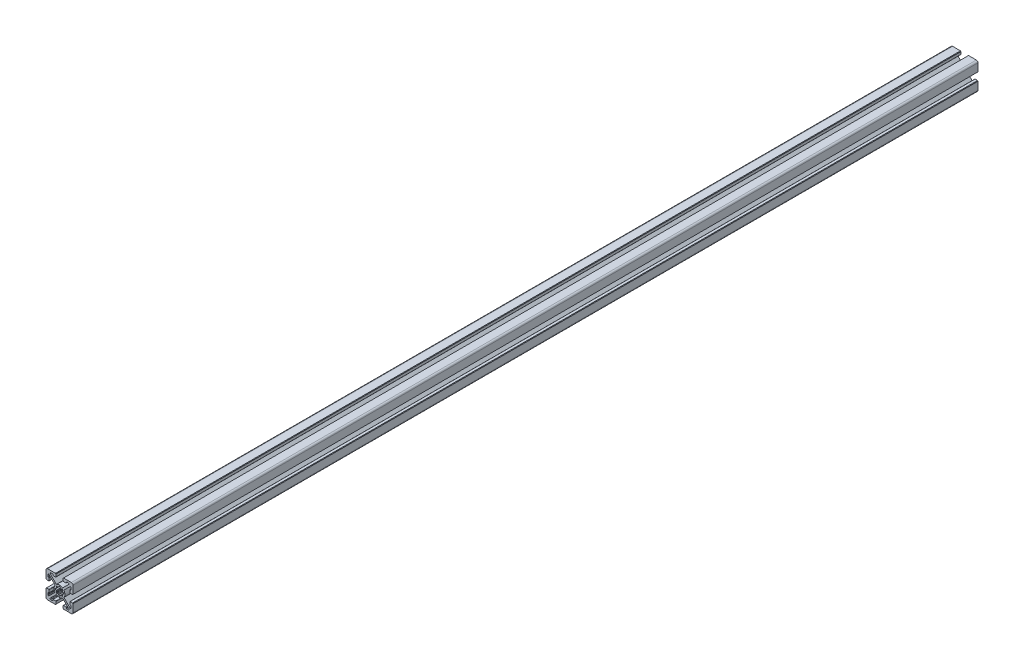
from build123d import *

# Parameters (mm, degrees)
SALIENTE_EXTRUIR1_DEPTH = 1005
REDONDEO1_R             = 0.3
REDONDEO2_R             = 1.8
CHAFL_N1_SIZE           = 0.5


with BuildPart() as part:
    # Croquis1 → Saliente-Extruir1 (new body)
    with BuildSketch(Plane.XY):
        with BuildLine():
            Line((4, 15), (15, 15))
            Line((15, 15), (15, 4))
            Line((15, 4), (11.5, 4))
            Line((11.5, 4), (11.5, 7.5))
            Line((11.5, 7.5), (13, 7.5))
            Line((13, 7.5), (13, 9.928932188))
            Line((13, 9.928932188), (12.171572875, 10.757359313))
            Line((12.171572875, 10.757359313), (4.890406914, 3.476193351))
            ThreePointArc((4.890406914, 3.476193351), (6, 0), (4.890406914, -3.476193351))
            Line((4.890406914, -3.476193351), (12.171572875, -10.757359313))
            Line((12.171572875, -10.757359313), (13, -9.928932188))
            Line((13, -9.928932188), (13, -7.5))
            Line((13, -7.5), (11.5, -7.5))
            Line((11.5, -7.5), (11.5, -4))
            Line((11.5, -4), (15, -4))
            Line((15, -4), (15, -15))
            Line((15, -15), (4, -15))
            Line((4, -15), (4, -11.5))
            Line((4, -11.5), (7.5, -11.5))
            Line((7.5, -11.5), (7.5, -13))
            Line((7.5, -13), (9.928932188, -13))
            Line((9.928932188, -13), (10.757359313, -12.171572875))
            Line((10.757359313, -12.171572875), (3.476193351, -4.890406914))
            ThreePointArc((3.476193351, -4.890406914), (0, -6), (-3.476193351, -4.890406914))
            Line((-3.476193351, -4.890406914), (-10.757359313, -12.171572875))
            Line((-10.757359313, -12.171572875), (-9.928932188, -13))
            Line((-9.928932188, -13), (-7.5, -13))
            Line((-7.5, -13), (-7.5, -11.5))
            Line((-7.5, -11.5), (-4, -11.5))
            Line((-4, -11.5), (-4, -15))
            Line((-4, -15), (-15, -15))
            Line((-15, -15), (-15, -4))
            Line((-15, -4), (-11.5, -4))
            Line((-11.5, -4), (-11.5, -7.5))
            Line((-11.5, -7.5), (-13, -7.5))
            Line((-13, -7.5), (-13, -9.928932188))
            Line((-13, -9.928932188), (-12.171572875, -10.757359313))
            Line((-12.171572875, -10.757359313), (-4.890406914, -3.476193351))
            ThreePointArc((-4.890406914, -3.476193351), (-6, 0), (-4.890406914, 3.476193351))
            Line((-4.890406914, 3.476193351), (-12.171572875, 10.757359313))
            Line((-12.171572875, 10.757359313), (-13, 9.928932188))
            Line((-13, 9.928932188), (-13, 7.5))
            Line((-13, 7.5), (-11.5, 7.5))
            Line((-11.5, 7.5), (-11.5, 4))
            Line((-11.5, 4), (-15, 4))
            Line((-15, 4), (-15, 15))
            Line((-15, 15), (-4, 15))
            Line((-4, 15), (-4, 11.5))
            Line((-4, 11.5), (-7.5, 11.5))
            Line((-7.5, 11.5), (-7.5, 13))
            Line((-7.5, 13), (-9.928932188, 13))
            Line((-9.928932188, 13), (-10.757359313, 12.171572875))
            Line((-10.757359313, 12.171572875), (-3.476193351, 4.890406914))
            ThreePointArc((-3.476193351, 4.890406914), (0, 6), (3.476193351, 4.890406914))
            Line((3.476193351, 4.890406914), (10.757359313, 12.171572875))
            Line((10.757359313, 12.171572875), (9.928932188, 13))
            Line((9.928932188, 13), (7.5, 13))
            Line((7.5, 13), (7.5, 11.5))
            Line((7.5, 11.5), (4, 11.5))
            Line((4, 11.5), (4, 15))
        make_face()
        with BuildLine():
            Line((-1, 3.614208074), (0, 5.25))
            Line((0, 5.25), (1, 3.614208074))
            ThreePointArc((1, 3.614208074), (1.435062871, 3.464548247), (1.848524256, 3.262737819))
            Line((1.848524256, 3.262737819), (3.712310601, 3.712310601))
            Line((3.712310601, 3.712310601), (3.262737819, 1.848524256))
            ThreePointArc((3.262737819, 1.848524256), (3.464548247, 1.435062871), (3.614208074, 1))
            Line((3.614208074, 1), (5.25, 0))
            Line((5.25, 0), (3.614208074, -1))
            ThreePointArc((3.614208074, -1), (3.464548247, -1.435062871), (3.262737819, -1.848524256))
            Line((3.262737819, -1.848524256), (3.712310601, -3.712310601))
            Line((3.712310601, -3.712310601), (1.848524256, -3.262737819))
            ThreePointArc((1.848524256, -3.262737819), (1.435062871, -3.464548247), (1, -3.614208074))
            Line((1, -3.614208074), (0, -5.25))
            Line((0, -5.25), (-1, -3.614208074))
            ThreePointArc((-1, -3.614208074), (-1.435062871, -3.464548247), (-1.848524256, -3.262737819))
            Line((-1.848524256, -3.262737819), (-3.712310601, -3.712310601))
            Line((-3.712310601, -3.712310601), (-3.262737819, -1.848524256))
            ThreePointArc((-3.262737819, -1.848524256), (-3.464548247, -1.435062871), (-3.614208074, -1))
            Line((-3.614208074, -1), (-5.25, 0))
            Line((-5.25, 0), (-3.614208074, 1))
            ThreePointArc((-3.614208074, 1), (-3.464548247, 1.435062871), (-3.262737819, 1.848524256))
            Line((-3.262737819, 1.848524256), (-3.712310601, 3.712310601))
            Line((-3.712310601, 3.712310601), (-1.848524256, 3.262737819))
            ThreePointArc((-1.848524256, 3.262737819), (-1.435062871, 3.464548247), (-1, 3.614208074))
        make_face(mode=Mode.SUBTRACT)
    extrude(amount=SALIENTE_EXTRUIR1_DEPTH)

    # Redondeo1
    redondeo1_edges = [part.edges().sort_by_distance(p)[0] for p in [
        (-12.171572875, 10.757359313, 502.5),
        (-13, 9.928932188, 502.5),
        (-13, 7.5, 502.5),
        (-11.5, 7.5, 502.5),
        (-11.5, 4, 502.5),
        (-4, 11.5, 502.5),
        (-7.5, 11.5, 502.5),
        (-7.5, 13, 502.5),
        (-9.928932188, 13, 502.5),
        (-10.757359313, 12.171572875, 502.5),
        (10.757359313, 12.171572875, 502.5),
        (9.928932188, 13, 502.5),
        (7.5, 13, 502.5),
        (7.5, 11.5, 502.5),
        (4, 11.5, 502.5),
        (11.5, 4, 502.5),
        (11.5, 7.5, 502.5),
        (13, 7.5, 502.5),
        (13, 9.928932188, 502.5),
        (12.171572875, 10.757359313, 502.5),
        (12.171572875, -10.757359313, 502.5),
        (13, -9.928932188, 502.5),
        (13, -7.5, 502.5),
        (11.5, -7.5, 502.5),
        (11.5, -4, 502.5),
        (4, -11.5, 502.5),
        (7.5, -11.5, 502.5),
        (7.5, -13, 502.5),
        (9.928932188, -13, 502.5),
        (10.757359313, -12.171572875, 502.5),
        (-10.757359313, -12.171572875, 502.5),
        (-9.928932188, -13, 502.5),
        (-7.5, -13, 502.5),
        (-7.5, -11.5, 502.5),
        (-4, -11.5, 502.5),
        (-11.5, -4, 502.5),
        (-11.5, -7.5, 502.5),
        (-13, -9.928932188, 502.5),
        (-12.171572875, -10.757359313, 502.5),
        (1, 3.614208074, 502.5),
        (0, 5.25, 502.5),
        (-1, 3.614208074, 502.5),
        (-1.848524256, 3.262737819, 502.5),
        (-3.712310601, 3.712310601, 502.5),
        (-3.262737819, 1.848524256, 502.5),
        (-3.614208074, 1, 502.5),
        (-5.25, 0, 502.5),
        (-3.614208074, -1, 502.5),
        (-3.262737819, -1.848524256, 502.5),
        (-3.712310601, -3.712310601, 502.5),
        (-1.848524256, -3.262737819, 502.5),
        (-1, -3.614208074, 502.5),
        (0, -5.25, 502.5),
        (1, -3.614208074, 502.5),
        (1.848524256, -3.262737819, 502.5),
        (3.712310601, -3.712310601, 502.5),
        (3.262737819, -1.848524256, 502.5),
        (3.614208074, -1, 502.5),
        (5.25, 0, 502.5),
        (3.614208074, 1, 502.5),
        (3.262737819, 1.848524256, 502.5),
        (3.712310601, 3.712310601, 502.5),
        (1.848524256, 3.262737819, 502.5),
    ]]
    fillet(redondeo1_edges, radius=REDONDEO1_R)

    # Redondeo2
    redondeo2_edges = [part.edges().sort_by_distance(p)[0] for p in [
        (-15, 15, 502.5),
        (15, 15, 502.5),
        (15, -15, 502.5),
        (-15, -15, 502.5),
    ]]
    fillet(redondeo2_edges, radius=REDONDEO2_R)

    # Chaflán1
    chafl_n1_edges = [part.edges().sort_by_distance(p)[0] for p in [
        (-15, 4, 502.5),
        (-4, 15, 502.5),
        (4, 15, 502.5),
        (15, 4, 502.5),
        (15, -4, 502.5),
        (4, -15, 502.5),
        (-4, -15, 502.5),
        (-15, -4, 502.5),
    ]]
    chamfer(chafl_n1_edges, length=CHAFL_N1_SIZE)


solid = part.part
